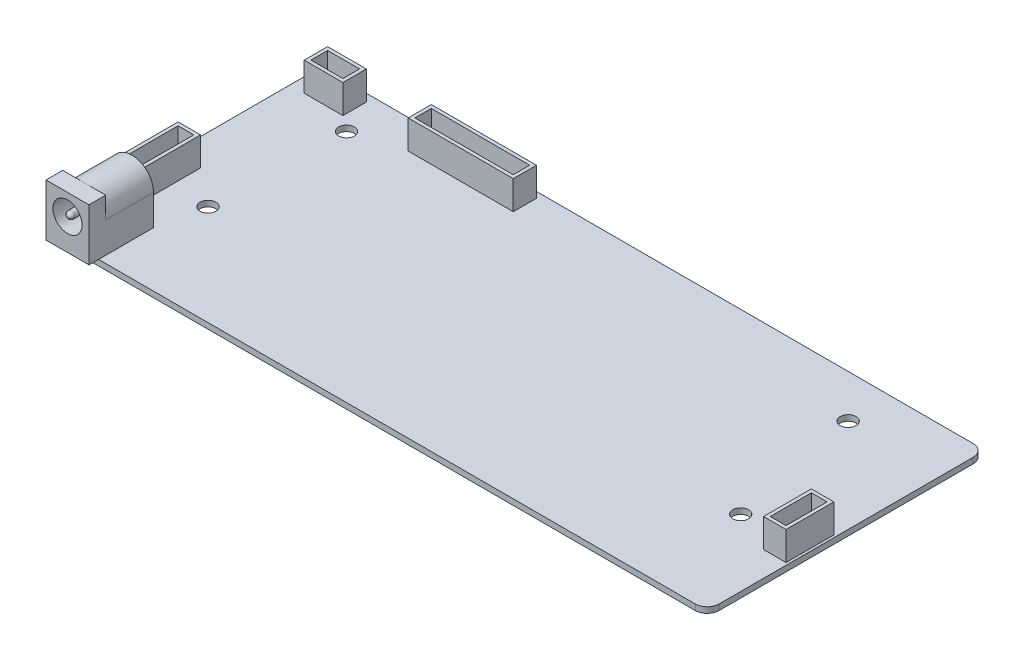
from build123d import *

# Parameters (mm, degrees)
BOSS_EXTRUDE1_DEPTH      = 0.6
BOSS_EXTRUDE1_DEPTH_BACK = 0.6
SKETCH1_R                = 1.65
SKETCH2_W                = 8.1
SKETCH2_H                = 4.9
SKETCH2_W_2              = 6.7
SKETCH2_H_2              = 3.5
SKETCH2_W_3              = 22
SKETCH2_H_3              = 4.85
SKETCH2_W_4              = 20.6
SKETCH2_H_4              = 3.45
SKETCH2_W_5              = 4.7
SKETCH2_H_5              = 14
SKETCH2_W_6              = 3.3
SKETCH2_H_6              = 12.6
SKETCH2_H_7              = 10
SKETCH2_H_8              = 8.6
BOSS_EXTRUDE2_DEPTH      = 6
SKETCH3_W                = 9
SKETCH3_H                = 13.5
BOSS_EXTRUDE3_DEPTH      = 10.9
CUT_EXTRUDE1_DEPTH       = 10
SKETCH5_R                = 3.05
SKETCH5_R_2              = 0.75
CUT_EXTRUDE2_DEPTH       = 11.9
FILLET1_R                = 0.75


with BuildPart() as part:
    # Sketch1 → Boss-Extrude1 (new, two sides: drawn at the far end of the back side and taken through both)
    with BuildSketch(Plane(origin=(0, 0, 0), x_dir=(1, 0, 0), z_dir=(0, 1, 0)).offset(-BOSS_EXTRUDE1_DEPTH_BACK)):
        with BuildLine():
            Line((-67, 29.075), (67, 29.075))
            ThreePointArc((67, 29.075), (68.767766953, 28.342766953), (69.5, 26.575))
            Line((69.5, 26.575), (69.5, -26.575))
            ThreePointArc((69.5, -26.575), (68.767766953, -28.342766953), (67, -29.075))
            Line((67, -29.075), (-67, -29.075))
            ThreePointArc((-67, -29.075), (-68.767766953, -28.342766953), (-69.5, -26.575))
            Line((-69.5, -26.575), (-69.5, 26.575))
            ThreePointArc((-69.5, 26.575), (-68.767766953, 28.342766953), (-67, 29.075))
        make_face()
        with Locations((-55.15, 20.075)):
            Circle(SKETCH1_R, mode=Mode.SUBTRACT)
        with Locations((49.85, 20.075)):
            Circle(SKETCH1_R, mode=Mode.SUBTRACT)
        with Locations((55.5, -8.075)):
            Circle(SKETCH1_R, mode=Mode.SUBTRACT)
        with Locations((-56, -8.075)):
            Circle(SKETCH1_R, mode=Mode.SUBTRACT)
    extrude(amount=BOSS_EXTRUDE1_DEPTH + BOSS_EXTRUDE1_DEPTH_BACK)

    # Sketch2 → Boss-Extrude2 (add)
    # profile 1 of 4: a face of its own
    with BuildSketch(Plane(origin=(0, 0.6, 0), x_dir=(1, 0, 0), z_dir=(0, 1, 0))):
        with Locations((-62.45, 25.025)):
            Rectangle(SKETCH2_W, SKETCH2_H)
        with Locations((-62.45, 25.025)):
            Rectangle(SKETCH2_W_2, SKETCH2_H_2, mode=Mode.SUBTRACT)
    # profile 2 of 4: a face of its own
    with BuildSketch(Plane(origin=(0, 0.6, 0), x_dir=(1, 0, 0), z_dir=(0, 1, 0))):
        with Locations((-34.15, 25.4)):
            Rectangle(SKETCH2_W_3, SKETCH2_H_3)
        with Locations((-34.15, 25.4)):
            Rectangle(SKETCH2_W_4, SKETCH2_H_4, mode=Mode.SUBTRACT)
    # profile 3 of 4: a face of its own
    with BuildSketch(Plane(origin=(0, 0.6, 0), x_dir=(1, 0, 0), z_dir=(0, 1, 0))):
        with Locations((-66.15, -8.825)):
            Rectangle(SKETCH2_W_5, SKETCH2_H_5)
        with Locations((-66.15, -8.825)):
            Rectangle(SKETCH2_W_6, SKETCH2_H_6, mode=Mode.SUBTRACT)
    # profile 4 of 4: a face of its own
    with BuildSketch(Plane(origin=(0, 0.6, 0), x_dir=(1, 0, 0), z_dir=(0, 1, 0))):
        with Locations((66.65, -7.075)):
            Rectangle(SKETCH2_W_5, SKETCH2_H_7)
        with Locations((66.65, -7.075)):
            Rectangle(SKETCH2_W_6, SKETCH2_H_8, mode=Mode.SUBTRACT)
    extrude(amount=BOSS_EXTRUDE2_DEPTH)

    # Sketch3 → Boss-Extrude3 (add)
    with BuildSketch(Plane(origin=(0, 0.6, 0), x_dir=(1, 0, 0), z_dir=(0, 1, 0))):
        with Locations((-62.4, -24.325)):
            Rectangle(SKETCH3_W, SKETCH3_H)
    extrude(amount=BOSS_EXTRUDE3_DEPTH)

    # Sketch4 → Cut-Extrude1 (cut)
    with BuildSketch(Plane(origin=(0, 0, 17.575), x_dir=(-1, 0, 0), z_dir=(0, 0, -1))):
        with BuildLine():
            Line((66.9, 11.5), (62.4, 11.5))
            ThreePointArc((62.4, 11.5), (65.581980515, 10.181980515), (66.9, 7))
            Line((66.9, 7), (66.9, 11.5))
        make_face()
        with BuildLine():
            Line((57.9, 11.5), (57.9, 7))
            ThreePointArc((57.9, 7), (59.218019485, 10.181980515), (62.4, 11.5))
            Line((62.4, 11.5), (57.9, 11.5))
        make_face()
    extrude(amount=-CUT_EXTRUDE1_DEPTH, mode=Mode.SUBTRACT)

    # Sketch5 → Cut-Extrude2 (cut)
    with BuildSketch(Plane.XY.offset(31.075)):
        with Locations((-62.4, 7.1)):
            Circle(SKETCH5_R)
        with Locations((-62.4, 7.1)):
            Circle(SKETCH5_R_2, mode=Mode.SUBTRACT)
    extrude(amount=-CUT_EXTRUDE2_DEPTH, mode=Mode.SUBTRACT)

    # Fillet1
    fillet1_edges = [part.edges().sort_by_distance(p)[0] for p in [
        (-63.15, 7.1, 31.075),
    ]]
    fillet(fillet1_edges, radius=FILLET1_R)


solid = part.part
